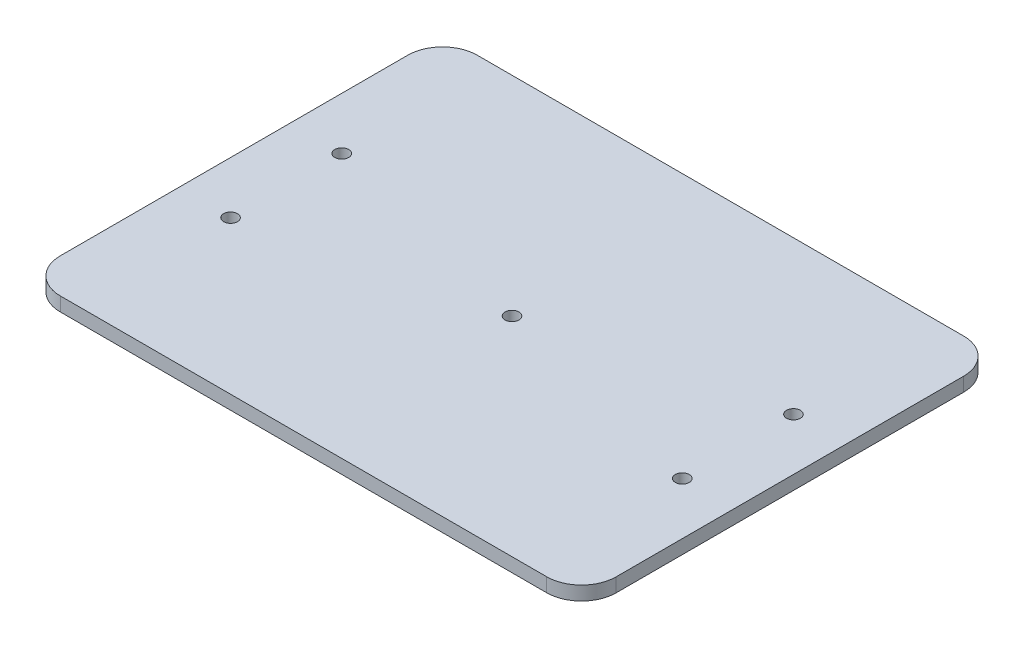
from build123d import *

# Parameters (mm, degrees)
SKETCH1_W           = 80
SKETCH1_H           = 60
BOSS_EXTRUDE2_DEPTH = 2
SKETCH3_R           = 1
CUT_EXTRUDE2_DEPTH  = 2
FILLET2_R           = 5


with BuildPart() as part:
    # Sketch1 → Boss-Extrude2 (new body)
    with BuildSketch(Plane(origin=(0, 0, 0), x_dir=(1, 0, 0), z_dir=(0, 1, 0))):
        with Locations((0.468384075, -9.016393443)):
            Rectangle(SKETCH1_W, SKETCH1_H)
    extrude(amount=BOSS_EXTRUDE2_DEPTH)

    # Sketch3 → Cut-Extrude2 (cut)
    with BuildSketch(Plane(origin=(0, 2, 0), x_dir=(1, 0, 0), z_dir=(0, 1, 0))):
        with Locations(Location((-32.031615925, -1.016393443, 0), (0, 0, 270))):
            Circle(SKETCH3_R)
        with Locations(Location((-32.031615925, -17.016393443, 0), (0, 0, 270))):
            Circle(SKETCH3_R)
        with Locations(Location((32.968384075, -1.016393443, 0), (0, 0, 270))):
            Circle(SKETCH3_R)
        with Locations(Location((32.968384075, -17.016393443, 0), (0, 0, 270))):
            Circle(SKETCH3_R)
        with Locations(Location((0.468384075, -9.016393443, 0), (0, 0, 270))):
            Circle(SKETCH3_R)
    extrude(amount=-CUT_EXTRUDE2_DEPTH, mode=Mode.SUBTRACT)

    # Fillet2
    fillet2_edges = [part.edges().sort_by_distance(p)[0] for p in [
        (-39.531615925, 1, -20.983606557),
        (40.468384075, 1, -20.983606557),
        (40.468384075, 1, 39.016393443),
        (-39.531615925, 1, 39.016393443),
    ]]
    fillet(fillet2_edges, radius=FILLET2_R)


solid = part.part
